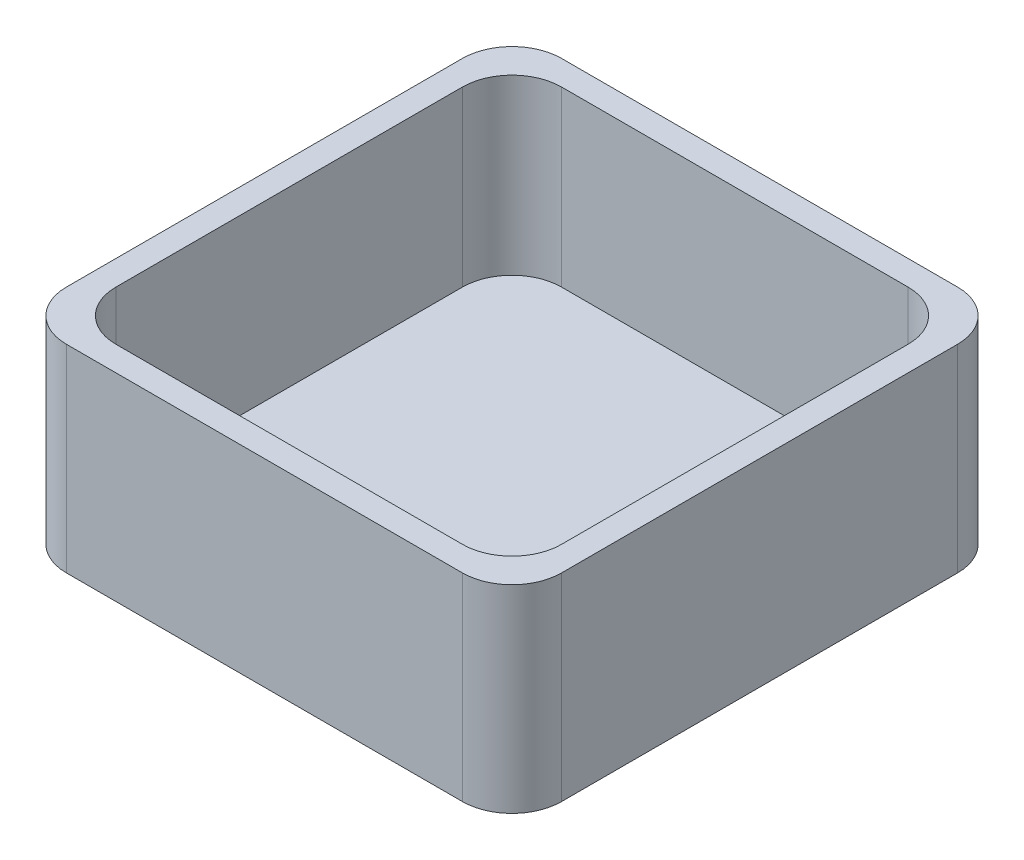
from build123d import *

# Parameters (mm, degrees)
SKETCH1_W           = 100
SKETCH1_H           = 100
BOSS_EXTRUDE1_DEPTH = 40
SKETCH2_W           = 90
SKETCH2_H           = 90
CUT_EXTRUDE1_DEPTH  = 35
FILLET1_R           = 10


with BuildPart() as part:
    # Sketch1 → Boss-Extrude1 (new body)
    with BuildSketch(Plane(origin=(0, 0, 0), x_dir=(1, 0, 0), z_dir=(0, 1, 0))):
        with Locations((50, -50)):
            Rectangle(SKETCH1_W, SKETCH1_H)
    extrude(amount=BOSS_EXTRUDE1_DEPTH)

    # Sketch2 → Cut-Extrude1 (cut)
    with BuildSketch(Plane(origin=(0, 40, 0), x_dir=(1, 0, 0), z_dir=(0, 1, 0))):
        with Locations((50, -50)):
            Rectangle(SKETCH2_W, SKETCH2_H)
    extrude(amount=-CUT_EXTRUDE1_DEPTH, mode=Mode.SUBTRACT)

    # Fillet1
    fillet1_edges = [part.edges().sort_by_distance(p)[0] for p in [
        (5, 22.5, 95),
        (5, 22.5, 5),
        (95, 22.5, 5),
        (95, 22.5, 95),
        (0, 20, 0),
        (100, 20, 0),
        (100, 20, 100),
        (0, 20, 100),
    ]]
    fillet(fillet1_edges, radius=FILLET1_R)


solid = part.part
